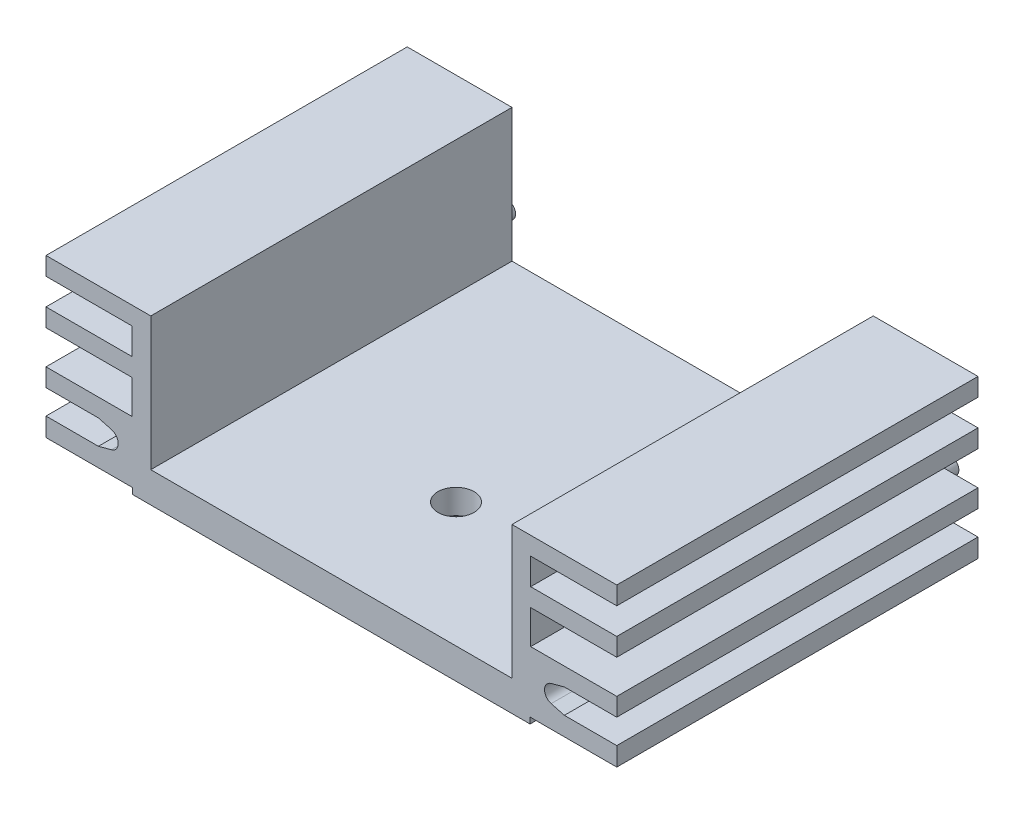
from build123d import *

# Parameters (mm, degrees)
BOSS_EXTRUDE1_DEPTH        = 15
SKETCH2_R                  = 1.5
CUT_EXTRUDE1_DEPTH         = 32.171300903
CHAMFER1_SIZE              = 0.5
BOSS_EXTRUDE2_DEPTH        = 3
BOSS_EXTRUDE2_DEPTH_BACK   = 7
SKETCH3_R                  = 0.705
BOSS_EXTRUDE2_2_DEPTH      = 3
BOSS_EXTRUDE2_2_DEPTH_BACK = 7


with BuildPart() as part:
    # Sketch1 → Boss-Extrude1 (new, symmetric)
    with BuildSketch(Plane.XY):
        with BuildLine():
            Line((-15, 13.1), (-15, 2.04))
            Line((-15, 2.04), (15, 2.04))
            Line((15, 2.04), (15, 13.1))
            Line((15, 13.1), (23.7, 13.1))
            Line((23.7, 13.1), (23.7, 11.6))
            Line((23.7, 11.6), (16.55, 11.6))
            Line((16.55, 11.6), (16.55, 9.4))
            Line((16.55, 9.4), (23.7, 9.4))
            Line((23.7, 9.4), (23.7, 7.9))
            Line((23.7, 7.9), (16.55, 7.9))
            Line((16.55, 7.9), (16.55, 5.09))
            Line((16.55, 5.09), (23.7, 5.09))
            Line((23.7, 5.09), (23.7, 3.59))
            Line((23.7, 3.59), (19.35, 3.59))
            Line((19.35, 3.59), (18.254412307, 3.294047964))
            ThreePointArc((18.254412307, 3.294047964), (17.7, 2.57), (18.254412307, 1.845952036))
            Line((18.254412307, 1.845952036), (19.35, 1.55))
            Line((19.35, 1.55), (23.7, 1.55))
            Line((23.7, 1.55), (23.7, 0))
            Line((23.7, 0), (16.5, 0))
            Line((16.5, 0), (16.5, -0.5))
            Line((16.5, -0.5), (-16.5, -0.5))
            Line((-16.5, -0.5), (-16.5, 0))
            Line((-16.5, 0), (-23.7, 0))
            Line((-23.7, 0), (-23.7, 1.55))
            Line((-23.7, 1.55), (-19.35, 1.55))
            Line((-19.35, 1.55), (-18.254412307, 1.845952036))
            ThreePointArc((-18.254412307, 1.845952036), (-17.7, 2.57), (-18.254412307, 3.294047964))
            Line((-18.254412307, 3.294047964), (-19.35, 3.59))
            Line((-19.35, 3.59), (-23.7, 3.59))
            Line((-23.7, 3.59), (-23.7, 5.09))
            Line((-23.7, 5.09), (-16.55, 5.09))
            Line((-16.55, 5.09), (-16.55, 7.9))
            Line((-16.55, 7.9), (-23.7, 7.9))
            Line((-23.7, 7.9), (-23.7, 9.4))
            Line((-23.7, 9.4), (-16.55, 9.4))
            Line((-16.55, 9.4), (-16.55, 11.6))
            Line((-16.55, 11.6), (-23.7, 11.6))
            Line((-23.7, 11.6), (-23.7, 13.1))
            Line((-23.7, 13.1), (-15, 13.1))
        make_face()
    extrude(amount=BOSS_EXTRUDE1_DEPTH, both=True)

    # Sketch2 → Cut-Extrude1 (cut, through all)
    with BuildSketch(Plane.XZ.offset(0.5)):
        with Locations(Location((0, 4.65, 0), (0, 0, 270))):
            Circle(SKETCH2_R)
    extrude(amount=-CUT_EXTRUDE1_DEPTH, mode=Mode.SUBTRACT)

    # Chamfer1
    chamfer1_edges = [part.edges().sort_by_distance(p)[0] for p in [
        (0, -0.5, 6.15),
    ]]
    chamfer(chamfer1_edges, length=CHAMFER1_SIZE)


with BuildPart() as body_2:
    # Sketch3 → Boss-Extrude2 (new, two sides: drawn at the far end of the back side and taken through both)
    with BuildSketch(Plane(origin=(0, 0, -15), x_dir=(-1, 0, 0), z_dir=(0, 0, -1)).offset(-BOSS_EXTRUDE2_DEPTH_BACK)):
        with Locations((-18.405, 2.57)):
            Circle(SKETCH3_R)
    extrude(amount=BOSS_EXTRUDE2_DEPTH + BOSS_EXTRUDE2_DEPTH_BACK)


with BuildPart() as body_3:
    # Sketch3 → Boss-Extrude2 2 (new, two sides: drawn at the far end of the back side and taken through both)
    with BuildSketch(Plane(origin=(0, 0, -15), x_dir=(-1, 0, 0), z_dir=(0, 0, -1)).offset(-BOSS_EXTRUDE2_2_DEPTH_BACK)):
        with Locations(Location((18.405, 2.57, 0), (0, 0, 180))):
            Circle(SKETCH3_R)
    extrude(amount=BOSS_EXTRUDE2_2_DEPTH + BOSS_EXTRUDE2_2_DEPTH_BACK)


solid = Compound([part.part, body_2.part, body_3.part])
